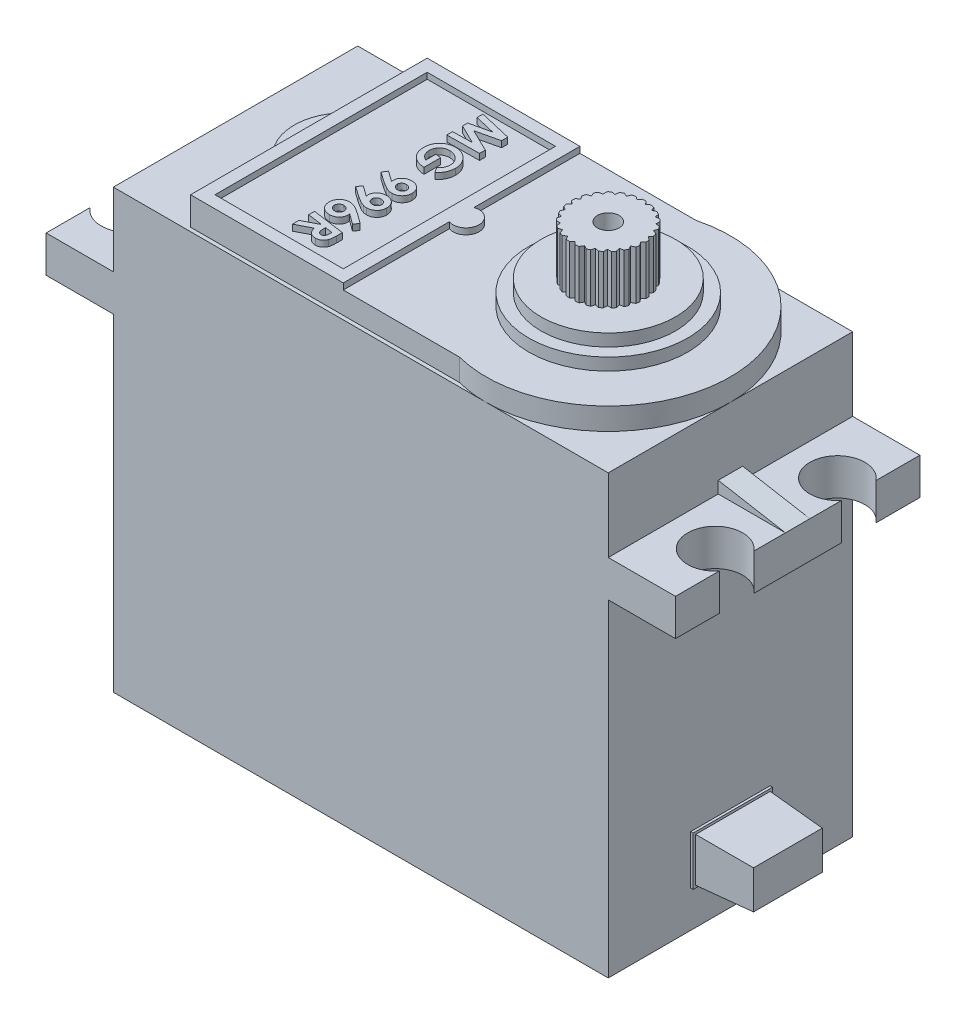
from build123d import *

# Parameters (mm, degrees)
ESQUISSE2_W             = 40.5
ESQUISSE2_H             = 20
BOSS_EXTRU_1_DEPTH      = 36.8
CHANFREIN1_SIZE         = 1
ESQUISSE3_W             = 6.5
ESQUISSE3_H             = 4
BOSS_EXTRU_2_DEPTH      = 0.2
ESQUISSE4_W             = 6.1
ESQUISSE4_H             = 3.6
BOSS_EXTRU_3_DEPTH      = 4.5
BOSS_EXTRU_3_TAPER      = 3
ESQUISSE5_W             = 5.5
ESQUISSE5_H             = 20
BOSS_EXTRU_4_DEPTH      = 3
BOSS_EXTRU_5_DEPTH      = 1.8
ESQUISSE8_W             = 12.5
ESQUISSE8_H             = 19.364916732
ESQUISSE8_W_2           = 10.5
ESQUISSE8_H_2           = 17.364916732
BOSS_EXTRU_6_DEPTH      = 0.5
NERVURE1_REACH          = 63.195
ESQUISSE6_WALL_W        = 129.97512572
ESQUISSE6_WALL_H        = 2
ESQUISSE9_R             = 2.25
ENL_V_MAT_EXTRU_1_DEPTH = 3
ESQUISSE10_R            = 1.069362743
BOSS_EXTRU_7_DEPTH      = 0.5
ESQUISSE11_R            = 6.5
BOSS_EXTRU_8_DEPTH      = 1
ESQUISSE12_R            = 5.5
BOSS_EXTRU_9_DEPTH      = 1
ESQUISSE13_R            = 3
BOSS_EXTRU_10_DEPTH     = 4
ENL_V_START             = -4
ENL_V_MAT_EXTRU_2_DEPTH = 4
TROU_TARAUD_2_561_D     = 1.778
TROU_TARAUD_2_561_DEPTH = 6.64
TROU_TARAUD_2_561_TIP   = 0.53416509
ENL_V_MAT_EXTRU_3_DEPTH = 0.5


with BuildPart() as part:
    # Esquisse2 → Boss.-Extru.1 (new body)
    with BuildSketch(Plane(origin=(0, 0, 0), x_dir=(1, 0, 0), z_dir=(0, 1, 0))):
        with Locations((20.25, 10)):
            Rectangle(ESQUISSE2_W, ESQUISSE2_H)
    extrude(amount=BOSS_EXTRU_1_DEPTH)

    # Chanfrein1
    chanfrein1_edges = [part.edges().sort_by_distance(p)[0] for p in [
        (20.25, 0, -20),
        (40.5, 0, -10),
        (20.25, 0, 0),
        (0, 0, -10),
    ]]
    chamfer(chanfrein1_edges, length=CHANFREIN1_SIZE)

    # Esquisse3 → Boss.-Extru.2 (add)
    with BuildSketch(Plane(origin=(40.5, 0, 0), x_dir=(0, 0, -1), z_dir=(1, 0, 0))):
        with Locations((10, 6)):
            Rectangle(ESQUISSE3_W, ESQUISSE3_H)
    extrude(amount=BOSS_EXTRU_2_DEPTH)

    # Esquisse4 → Boss.-Extru.3 (add)
    with BuildSketch(Plane(origin=(40.7, 0, 0), x_dir=(0, 0, -1), z_dir=(1, 0, 0))):
        with Locations((10, 6)):
            Rectangle(ESQUISSE4_W, ESQUISSE4_H)
    extrude(amount=BOSS_EXTRU_3_DEPTH, taper=BOSS_EXTRU_3_TAPER)

    # Esquisse5 → Boss.-Extru.4 (add)
    with BuildSketch(Plane(origin=(0, 30.8, 0), x_dir=(1, 0, 0), z_dir=(0, 1, 0))):
        with Locations((43.25, 10)):
            Rectangle(ESQUISSE5_W, ESQUISSE5_H)
        with Locations((-2.75, 10)):
            Rectangle(ESQUISSE5_W, ESQUISSE5_H)
    extrude(amount=-BOSS_EXTRU_4_DEPTH)

    # Esquisse7 → Boss.-Extru.5 (add)
    with BuildSketch(Plane(origin=(0, 36.8, 0), x_dir=(1, 0, 0), z_dir=(0, 1, 0))):
        with BuildLine():
            Line((28, 19.682458366), (6, 19.682458366))
            Line((6, 19.682458366), (6, 12.939387691))
            ThreePointArc((6, 12.939387691), (4.8, 10), (6, 7.060612309))
            Line((6, 7.060612309), (6, 0.317541634))
            Line((6, 0.317541634), (28, 0.317541634))
            ThreePointArc((28, 0.317541634), (40.5, 10), (28, 19.682458366))
        make_face()
    extrude(amount=BOSS_EXTRU_5_DEPTH)

    # Esquisse8 → Boss.-Extru.6 (add)
    with BuildSketch(Plane(origin=(0, 38.6, 0), x_dir=(1, 0, 0), z_dir=(0, 1, 0))):
        with Locations((12.25, 10)):
            Rectangle(ESQUISSE8_W, ESQUISSE8_H)
        with Locations((12.25, 10)):
            Rectangle(ESQUISSE8_W_2, ESQUISSE8_H_2, mode=Mode.SUBTRACT)
    extrude(amount=BOSS_EXTRU_6_DEPTH)

    # Esquisse6 wall → Nervure1 (add, up to next)
    with BuildSketch(Plane(origin=(43.25, 31.28654897, -10), x_dir=(-0.98470656344, 0.17422107771, 0), z_dir=(0.17422107771, 0.98470656344, 0)), mode=Mode.PRIVATE) as nervure1_sk1:
        Rectangle(ESQUISSE6_WALL_W, ESQUISSE6_WALL_H)
    nervure1_tool1 = extrude(nervure1_sk1.sketch, amount=-NERVURE1_REACH, mode=Mode.PRIVATE) - part.part
    nervure1 = nervure1_tool1.solids().sort_by_distance((43.25, 31.28654897, -10))[0]
    add(nervure1)

    # Symétrie1: Nervure1 across plane
    add(nervure1.mirror(Plane.ZY.offset(-20.25)))

    # Esquisse9 → Enlèv. mat.-Extru.1 (cut)
    with BuildSketch(Plane(origin=(0, 30.8, 0), x_dir=(1, 0, 0), z_dir=(0, 1, 0))):
        with Locations((-3.75, 15)):
            Circle(ESQUISSE9_R)
        with Locations((-3.75, 5)):
            Circle(ESQUISSE9_R)
        with Locations((44.25, 15)):
            Circle(ESQUISSE9_R)
        with Locations((44.25, 5)):
            Circle(ESQUISSE9_R)
    extrude(amount=-ENL_V_MAT_EXTRU_1_DEPTH, mode=Mode.SUBTRACT)

    # Esquisse10 → Boss.-Extru.7 (add)
    # profile 1 of 7: a face of its own
    with BuildSketch(Plane(origin=(0, 38.6, 0), x_dir=(1, 0, 0), z_dir=(0, 1, 0))):
        with Locations((18.863979038, 10)):
            Circle(ESQUISSE10_R)
    # profile 2 of 7: a face of its own
    with BuildSketch(Plane(origin=(0, 38.6, 0), x_dir=(1, 0, 0), z_dir=(0, 1, 0))):
        Polygon((14.895833333, 17.378864517), (14.895833333, 16.873760517), (13.052442241, 16.444978632), (14.895833333, 15.539713542), (14.895833333, 15.071180556), (12.25, 15.037259615), (12.25, 15.512152778), (13.832623865, 15.546073718), (12.25, 16.323075254), (12.25, 16.737016727), (13.912126068, 17.123397436), (12.25, 17.514018263), (12.25, 18.000571748), align=None)
    # profile 3 of 7: a face of its own
    with BuildSketch(Plane(origin=(0, 38.6, 0), x_dir=(1, 0, 0), z_dir=(0, 1, 0))):
        with BuildLine():
            Line((14.413519965, 11.893212473), (14.14957265, 12.314574152))
            add(Edge.make_bspline(
                [(14.14957265, 12.314574152), (14.182226607, 12.344452028), (14.244607538, 12.401529634), (14.325928731, 12.491063998), (14.391922335, 12.578848082), (14.441898984, 12.667154377), (14.478787705, 12.757700404), (14.503895804, 12.852666333), (14.519754731, 12.95306459), (14.521705169, 13.021906131), (14.522702991, 13.057124733)],
                knots=[0, 0, 0, 0, 1.232885797, 2.355260147, 3.365556625, 4.287066597, 5.174814994, 6.082477048, 7.019015608, 8, 8, 8, 8], degree=3))
            add(Edge.make_bspline(
                [(14.522702991, 13.057124733), (14.521686925, 13.095364384), (14.519689994, 13.170518887), (14.500873636, 13.280150935), (14.471871138, 13.384693694), (14.430547824, 13.483730957), (14.37602753, 13.576738756), (14.310603553, 13.664500855), (14.233259477, 13.746911503), (14.174343486, 13.795530523), (14.144272503, 13.820345887)],
                knots=[0, 0, 0, 0, 1.037071857, 2.038214738, 3.009729149, 3.976855325, 4.941565424, 5.928389831, 6.942640983, 8, 8, 8, 8], degree=3))
            add(Edge.make_bspline(
                [(14.144272503, 13.820345887), (14.119098074, 13.838925772), (14.069293607, 13.875683755), (13.990748516, 13.923561019), (13.909783045, 13.96314346), (13.827256952, 13.9966325), (13.742303924, 14.021687181), (13.655425835, 14.040764914), (13.566285141, 14.051240002), (13.506159608, 14.052778618), (13.475923978, 14.05355235)],
                knots=[0, 0, 0, 0, 1.040839251, 2.059170575, 3.055630366, 4.037062373, 5.019110465, 5.999220985, 6.993858158, 8, 8, 8, 8], degree=3))
            add(Edge.make_bspline(
                [(13.475923978, 14.05355235), (13.446389285, 14.052838649), (13.388165025, 14.051431667), (13.302693434, 14.040347229), (13.221068283, 14.020814449), (13.142669436, 13.995202178), (13.068207437, 13.960903979), (12.997347209, 13.919389191), (12.930280706, 13.870317718), (12.86756691, 13.81430086), (12.810308914, 13.753008656), (12.76012294, 13.687570953), (12.717880889, 13.618626076), (12.683290563, 13.546146381), (12.656064777, 13.470176978), (12.637183746, 13.390531597), (12.625034783, 13.307666938), (12.623771226, 13.251153353), (12.623130342, 13.222489316)],
                knots=[0, 0, 0, 0, 1.066897471, 2.103265977, 3.106535126, 4.095591644, 5.078159493, 6.062322472, 7.058152725, 8.075375883, 9.096057735, 10.084186963, 11.049730852, 12.011871914, 12.980953841, 13.959387168, 14.96498868, 16, 16, 16, 16], degree=3))
            add(Edge.make_bspline(
                [(12.623130342, 13.222489316), (12.62352997, 13.200919765), (12.624321167, 13.158215716), (12.630867198, 13.094984655), (12.641499585, 13.033188568), (12.656192684, 12.972909638), (12.675512208, 12.914154242), (12.698930203, 12.856798498), (12.726293103, 12.80068424), (12.758406832, 12.746436633), (12.794238655, 12.693968773), (12.834685352, 12.644022395), (12.879496236, 12.596709454), (12.928435307, 12.551650676), (12.98124162, 12.508551759), (13.039018432, 12.46894969), (13.100490782, 12.431075996), (13.143816269, 12.408311625), (13.165865385, 12.396726429)],
                knots=[0, 0, 0, 0, 0.990751711, 1.961520103, 2.916931976, 3.869720035, 4.809138875, 5.755683625, 6.713987145, 7.674487982, 8.649319602, 9.630449541, 10.623757948, 11.640402946, 12.684918653, 13.752145235, 14.856026455, 16, 16, 16, 16], degree=3))
            Line((13.165865385, 12.396726429), (13.165865385, 13.232029581))
            Line((13.165865385, 13.232029581), (13.606837607, 13.171607906))
            Line((13.606837607, 13.171607906), (13.606837607, 11.814770299))
            add(Edge.make_bspline(
                [(13.606837607, 11.814770299), (13.553576953, 11.818164211), (13.449423544, 11.824801144), (13.297763777, 11.848819667), (13.154737828, 11.884392058), (13.019794624, 11.930502134), (12.893185857, 11.987615425), (12.775254695, 12.056619555), (12.665557739, 12.136162474), (12.565533037, 12.226966773), (12.475782242, 12.326397844), (12.396489875, 12.432596793), (12.330718138, 12.54636996), (12.276386727, 12.666200695), (12.233654404, 12.792560622), (12.203696237, 12.925771009), (12.185230178, 13.065613979), (12.183194733, 13.161126321), (12.18215812, 13.209768964)],
                knots=[0, 0, 0, 0, 1.148955532, 2.246830018, 3.301660101, 4.319666133, 5.314146826, 6.287838685, 7.257462643, 8.227280698, 9.191724348, 10.138440807, 11.076252923, 12.016254752, 12.968042649, 13.943717582, 14.952773983, 16, 16, 16, 16], degree=3))
            add(Edge.make_bspline(
                [(12.18215812, 13.209768964), (12.182422747, 13.236454621), (12.182945535, 13.289173934), (12.188315617, 13.367019666), (12.197484811, 13.442677664), (12.209525355, 13.516102052), (12.224926848, 13.587610509), (12.243849953, 13.656857329), (12.266805344, 13.724078008), (12.293385572, 13.788833866), (12.322306691, 13.852052819), (12.356049468, 13.912245692), (12.392500992, 13.970865644), (12.432978605, 14.026931448), (12.476454014, 14.081266613), (12.523609892, 14.133053839), (12.574262899, 14.1827447), (12.610237054, 14.213807595), (12.628430489, 14.229517228)],
                knots=[0, 0, 0, 0, 1.111489437, 2.195822267, 3.24832009, 4.285186852, 5.294177098, 6.294000398, 7.273796753, 8.250936178, 9.209044775, 10.167605497, 11.123223585, 12.083111191, 13.046265838, 14.020518746, 14.998904505, 16, 16, 16, 16], degree=3))
            add(Edge.make_bspline(
                [(12.628430489, 14.229517228), (12.658588763, 14.253396792), (12.718466815, 14.300808715), (12.814947345, 14.361673055), (12.915566575, 14.413613317), (13.020838592, 14.455207788), (13.12995092, 14.488460722), (13.243503183, 14.511673433), (13.361266447, 14.525638713), (13.441258231, 14.527502148), (13.48175414, 14.528445513)],
                knots=[0, 0, 0, 0, 0.999328569, 1.984127054, 2.959716786, 3.938705326, 4.922250225, 5.921072174, 6.947541011, 8, 8, 8, 8], degree=3))
            add(Edge.make_bspline(
                [(13.48175414, 14.528445513), (13.53129847, 14.527173323), (13.629061566, 14.52466298), (13.77282981, 14.503175961), (13.911565339, 14.469386095), (14.045327899, 14.42159429), (14.173480699, 14.359024131), (14.296477058, 14.283156585), (14.414850664, 14.194334344), (14.525642072, 14.092177215), (14.628023605, 13.981364426), (14.717958358, 13.863705939), (14.793658228, 13.740327698), (14.856346862, 13.612238591), (14.904011351, 13.478215362), (14.938507887, 13.339436142), (14.959884545, 13.195238002), (14.962398803, 13.097302998), (14.963675214, 13.047584468)],
                knots=[0, 0, 0, 0, 1.022497491, 2.017637963, 2.994389496, 3.967079589, 4.944335062, 5.93346684, 6.946839843, 7.995112064, 9.040696054, 10.058471571, 11.04760335, 12.024858823, 12.997548916, 13.978718102, 14.973858573, 16, 16, 16, 16], degree=3))
            add(Edge.make_bspline(
                [(14.963675214, 13.047584468), (14.963073734, 13.010268263), (14.96187604, 12.935962555), (14.948764051, 12.825348338), (14.929734364, 12.715895027), (14.901241146, 12.608753554), (14.866779416, 12.50483789), (14.825069394, 12.405472052), (14.77709042, 12.311265198), (14.721760549, 12.221593179), (14.658650029, 12.135656527), (14.58655147, 12.051845362), (14.504433106, 11.970418038), (14.444260862, 11.919318362), (14.413519965, 11.893212473)],
                knots=[0, 0, 0, 0, 1.013985835, 2.019094276, 3.024340414, 4.032027573, 5.029903266, 5.998629461, 6.958804651, 7.901192451, 8.859925033, 9.854431412, 10.903868303, 12, 12, 12, 12], degree=3))
        make_face()
    # profile 4 of 7: a face of its own
    with BuildSketch(Plane(origin=(0, 38.6, 0), x_dir=(1, 0, 0), z_dir=(0, 1, 0))):
        with BuildLine():
            Line((12.18215812, 9.722272302), (12.428084936, 10.089572483))
            Line((12.428084936, 10.089572483), (13.292008881, 9.478465545))
            add(Edge.make_bspline(
                [(13.292008881, 9.478465545), (13.285044745, 9.507656953), (13.271936971, 9.562600513), (13.269003247, 9.618990213), (13.267628205, 9.645420172)],
                knots=[0, 0, 0, 0, 1.062596194, 2, 2, 2, 2], degree=3))
            add(Edge.make_bspline(
                [(13.267628205, 9.645420172), (13.268370326, 9.669484416), (13.269834611, 9.716965777), (13.280592147, 9.786868361), (13.298781282, 9.853969752), (13.323754696, 9.91858972), (13.356185706, 9.980380058), (13.396602665, 10.038934361), (13.443356714, 10.095229716), (13.496534781, 10.148553985), (13.555489352, 10.196736567), (13.618316863, 10.239579909), (13.684811225, 10.275591006), (13.754446078, 10.305488754), (13.827595228, 10.328505371), (13.904383904, 10.343920384), (13.984439422, 10.354607871), (14.039116571, 10.355643708), (14.066890358, 10.356169872)],
                knots=[0, 0, 0, 0, 0.970086177, 1.914085144, 2.843757081, 3.768448548, 4.702069427, 5.650466095, 6.631863717, 7.649361026, 8.681859104, 9.697409525, 10.711084413, 11.725960042, 12.748829391, 13.796646255, 14.880785151, 16, 16, 16, 16], degree=3))
            add(Edge.make_bspline(
                [(14.066890358, 10.356169872), (14.098197844, 10.355518936), (14.159801729, 10.354238085), (14.250317834, 10.342276224), (14.336868289, 10.322673607), (14.419579012, 10.2957472), (14.497774244, 10.260469755), (14.572078653, 10.217814045), (14.642299223, 10.16708307), (14.708049837, 10.109288105), (14.76770795, 10.045249169), (14.820616324, 9.976906928), (14.864955402, 9.903596822), (14.900928581, 9.826020649), (14.929315065, 9.744194602), (14.949369106, 9.658239669), (14.961103379, 9.567831814), (14.962805317, 9.506237563), (14.963675214, 9.474755442)],
                knots=[0, 0, 0, 0, 1.067153374, 2.099842657, 3.106801845, 4.089832761, 5.060584944, 6.026765153, 7.006523203, 8.009636506, 9.007035051, 9.986663441, 10.951659663, 11.921944397, 12.897414564, 13.899858298, 14.926573288, 16, 16, 16, 16], degree=3))
            add(Edge.make_bspline(
                [(14.963675214, 9.474755442), (14.963051152, 9.446088804), (14.961824572, 9.389745137), (14.949549956, 9.307470148), (14.931272291, 9.228678737), (14.904666719, 9.153625098), (14.86994262, 9.082315393), (14.827840697, 9.014643187), (14.778218026, 8.950774394), (14.721695011, 8.891211855), (14.659741804, 8.837106924), (14.593764232, 8.789645513), (14.524432178, 8.749486789), (14.451309401, 8.717100659), (14.374775546, 8.691728494), (14.295030193, 8.672898961), (14.211692758, 8.66233727), (14.155078169, 8.660869964), (14.126252003, 8.660122863)],
                knots=[0, 0, 0, 0, 1.054249505, 2.072105013, 3.054563783, 4.027228313, 4.995537151, 5.967962625, 6.955035867, 7.966830736, 8.985184481, 9.977553814, 10.953342403, 11.928372592, 12.915253103, 13.916696589, 14.939254872, 16, 16, 16, 16], degree=3))
            add(Edge.make_bspline(
                [(14.126252003, 8.660122863), (14.102914166, 8.660489033), (14.056488057, 8.661217456), (13.987588394, 8.668329291), (13.919779494, 8.679961529), (13.875492157, 8.691107359), (13.853294438, 8.696693877)],
                knots=[0, 0, 0, 0, 1.013662365, 2.016484985, 3.005821674, 4, 4, 4, 4], degree=3))
            add(Edge.make_bspline(
                [(13.853294438, 8.696693877), (13.821887718, 8.706370116), (13.759147027, 8.725700181), (13.667547042, 8.761743499), (13.577671496, 8.801709608), (13.519749284, 8.832393511), (13.49076439, 8.847748064)],
                knots=[0, 0, 0, 0, 1.00191864, 2.001516544, 2.999937518, 4, 4, 4, 4], degree=3))
            add(Edge.make_bspline(
                [(13.49076439, 8.847748064), (13.441653178, 8.874830127), (13.345151324, 8.928045457), (13.205430961, 9.011901855), (13.071945365, 9.095963773), (12.986700987, 9.154861062), (12.944849259, 9.183777377)],
                knots=[0, 0, 0, 0, 1.049210121, 2.061662041, 3.048350216, 4, 4, 4, 4], degree=3))
            Line((12.944849259, 9.183777377), (12.18215812, 9.722272302))
        make_face()
        with BuildLine():
            add(Edge.make_bspline(
                [(13.708600427, 9.524576823), (13.709035217, 9.511479633), (13.709897329, 9.485510159), (13.715941075, 9.447349734), (13.725212391, 9.410397192), (13.739586639, 9.375402111), (13.75610301, 9.340901898), (13.778364906, 9.308978323), (13.803206007, 9.277666857), (13.832488349, 9.249102596), (13.863528526, 9.222008653), (13.897627985, 9.199422824), (13.932225857, 9.178769487), (13.969324504, 9.163200063), (14.007258901, 9.150034634), (14.047232721, 9.14207625), (14.088234294, 9.135580956), (14.116330443, 9.135205348), (14.130492121, 9.135016026)],
                knots=[0, 0, 0, 0, 0.985210318, 1.953502403, 2.901504212, 3.844552657, 4.795811415, 5.772915833, 6.765364857, 7.799414466, 8.846288802, 9.8603182, 10.872777757, 11.873031683, 12.88199396, 13.888500911, 14.935712839, 16, 16, 16, 16], degree=3))
            add(Edge.make_bspline(
                [(14.130492121, 9.135016026), (14.157143961, 9.13604922), (14.209147112, 9.138065192), (14.283241468, 9.159330417), (14.351318483, 9.191840168), (14.400879842, 9.230569974), (14.435944253, 9.266404387), (14.459417419, 9.294714951), (14.478648472, 9.325214323), (14.495268824, 9.356524442), (14.507446426, 9.390138865), (14.51644421, 9.424897614), (14.521948085, 9.461330131), (14.522448573, 9.486043361), (14.522702991, 9.498606103)],
                knots=[0, 0, 0, 0, 1.605710682, 3.133067493, 4.617246605, 6.139001981, 6.901113253, 7.644390981, 8.354770773, 9.075414747, 9.781050313, 10.508300066, 11.241708108, 12, 12, 12, 12], degree=3))
            add(Edge.make_bspline(
                [(14.522702991, 9.498606103), (14.522269913, 9.511877837), (14.521416852, 9.53801998), (14.515432771, 9.576394246), (14.505848066, 9.613140623), (14.492811368, 9.648395673), (14.474739767, 9.681484135), (14.453796485, 9.713340538), (14.428323669, 9.74334752), (14.399563232, 9.771525131), (14.368061273, 9.797369413), (14.334280593, 9.819814185), (14.298862501, 9.838986534), (14.261454941, 9.854239777), (14.222551458, 9.86677054), (14.181632759, 9.874880111), (14.138956083, 9.880581667), (14.109841649, 9.881041833), (14.094981136, 9.881276709)],
                knots=[0, 0, 0, 0, 0.99542305, 1.960745347, 2.905839599, 3.841219243, 4.772081027, 5.727802437, 6.696757192, 7.718306701, 8.745001724, 9.748509204, 10.756557466, 11.760764865, 12.775153388, 13.817469606, 14.885998626, 16, 16, 16, 16], degree=3))
            add(Edge.make_bspline(
                [(14.094981136, 9.881276709), (14.068706262, 9.880141045), (14.017537033, 9.877929387), (13.944133473, 9.858128398), (13.877187411, 9.826087871), (13.828333169, 9.788589095), (13.793554419, 9.754137239), (13.770977448, 9.726130977), (13.751346378, 9.69670676), (13.736291493, 9.665301665), (13.723777186, 9.632565508), (13.714818203, 9.598112565), (13.709359371, 9.561853625), (13.708856206, 9.537139845), (13.708600427, 9.524576823)],
                knots=[0, 0, 0, 0, 1.609136234, 3.133726194, 4.626556867, 6.135078296, 6.886042596, 7.625661421, 8.33802277, 9.050466543, 9.75695111, 10.485047691, 11.229887978, 12, 12, 12, 12], degree=3))
        make_face(mode=Mode.SUBTRACT)
    # profile 5 of 7: a face of its own
    with BuildSketch(Plane(origin=(0, 38.6, 0), x_dir=(1, 0, 0), z_dir=(0, 1, 0))):
        with BuildLine():
            Line((12.18215812, 7.653094952), (12.428084936, 8.020395132))
            Line((12.428084936, 8.020395132), (13.292008881, 7.409288194))
            add(Edge.make_bspline(
                [(13.292008881, 7.409288194), (13.285044745, 7.438479603), (13.271936971, 7.493423162), (13.269003247, 7.549812862), (13.267628205, 7.576242822)],
                knots=[0, 0, 0, 0, 1.062596194, 2, 2, 2, 2], degree=3))
            add(Edge.make_bspline(
                [(13.267628205, 7.576242822), (13.268370326, 7.600307066), (13.269834611, 7.647788427), (13.280592147, 7.717691011), (13.298781282, 7.784792402), (13.323754696, 7.84941237), (13.356185706, 7.911202708), (13.396602665, 7.96975701), (13.443356714, 8.026052366), (13.496534781, 8.079376634), (13.555489352, 8.127559217), (13.618316863, 8.170402559), (13.684811225, 8.206413656), (13.754446078, 8.236311403), (13.827595228, 8.259328021), (13.904383904, 8.274743034), (13.984439422, 8.285430521), (14.039116571, 8.286466358), (14.066890358, 8.286992521)],
                knots=[0, 0, 0, 0, 0.970086177, 1.914085144, 2.843757081, 3.768448548, 4.702069427, 5.650466095, 6.631863717, 7.649361026, 8.681859104, 9.697409525, 10.711084413, 11.725960042, 12.748829391, 13.796646255, 14.880785151, 16, 16, 16, 16], degree=3))
            add(Edge.make_bspline(
                [(14.066890358, 8.286992521), (14.098197844, 8.286341585), (14.159801729, 8.285060735), (14.250317834, 8.273098874), (14.336868289, 8.253496257), (14.419579012, 8.22656985), (14.497774244, 8.191292404), (14.572078653, 8.148636695), (14.642299223, 8.09790572), (14.708049837, 8.040110754), (14.76770795, 7.976071819), (14.820616324, 7.907729577), (14.864955402, 7.834419472), (14.900928581, 7.756843298), (14.929315065, 7.675017251), (14.949369106, 7.589062318), (14.961103379, 7.498654464), (14.962805317, 7.437060212), (14.963675214, 7.405578092)],
                knots=[0, 0, 0, 0, 1.067153374, 2.099842657, 3.106801845, 4.089832761, 5.060584944, 6.026765153, 7.006523203, 8.009636506, 9.007035051, 9.986663441, 10.951659663, 11.921944397, 12.897414564, 13.899858298, 14.926573288, 16, 16, 16, 16], degree=3))
            add(Edge.make_bspline(
                [(14.963675214, 7.405578092), (14.963051152, 7.376911454), (14.961824572, 7.320567786), (14.949549956, 7.238292797), (14.931272291, 7.159501386), (14.904666719, 7.084447748), (14.86994262, 7.013138043), (14.827840697, 6.945465836), (14.778218026, 6.881597044), (14.721695011, 6.822034504), (14.659741804, 6.767929574), (14.593764232, 6.720468163), (14.524432178, 6.680309439), (14.451309401, 6.647923309), (14.374775546, 6.622551144), (14.295030193, 6.60372161), (14.211692758, 6.593159919), (14.155078169, 6.591692613), (14.126252003, 6.590945513)],
                knots=[0, 0, 0, 0, 1.054249505, 2.072105013, 3.054563783, 4.027228313, 4.995537151, 5.967962625, 6.955035867, 7.966830736, 8.985184481, 9.977553814, 10.953342403, 11.928372592, 12.915253103, 13.916696589, 14.939254872, 16, 16, 16, 16], degree=3))
            add(Edge.make_bspline(
                [(14.126252003, 6.590945513), (14.102914166, 6.591311682), (14.056488057, 6.592040106), (13.987588394, 6.59915194), (13.919779494, 6.610784179), (13.875492157, 6.621930009), (13.853294438, 6.627516526)],
                knots=[0, 0, 0, 0, 1.013662365, 2.016484985, 3.005821674, 4, 4, 4, 4], degree=3))
            add(Edge.make_bspline(
                [(13.853294438, 6.627516526), (13.821887718, 6.637192765), (13.759147027, 6.65652283), (13.667547042, 6.692566149), (13.577671496, 6.732532258), (13.519749284, 6.76321616), (13.49076439, 6.778570713)],
                knots=[0, 0, 0, 0, 1.00191864, 2.001516544, 2.999937518, 4, 4, 4, 4], degree=3))
            add(Edge.make_bspline(
                [(13.49076439, 6.778570713), (13.441653178, 6.805652777), (13.345151324, 6.858868107), (13.205430961, 6.942724505), (13.071945365, 7.026786422), (12.986700987, 7.085683711), (12.944849259, 7.114600027)],
                knots=[0, 0, 0, 0, 1.049210121, 2.061662041, 3.048350216, 4, 4, 4, 4], degree=3))
            Line((12.944849259, 7.114600027), (12.18215812, 7.653094952))
        make_face()
        with BuildLine():
            add(Edge.make_bspline(
                [(13.708600427, 7.455399472), (13.709035217, 7.442302282), (13.709897329, 7.416332809), (13.715941075, 7.378172383), (13.725212391, 7.341219842), (13.739586639, 7.30622476), (13.75610301, 7.271724548), (13.778364906, 7.239800973), (13.803206007, 7.208489506), (13.832488349, 7.179925245), (13.863528526, 7.152831302), (13.897627985, 7.130245474), (13.932225857, 7.109592136), (13.969324504, 7.094022712), (14.007258901, 7.080857283), (14.047232721, 7.0728989), (14.088234294, 7.066403606), (14.116330443, 7.066027998), (14.130492121, 7.065838675)],
                knots=[0, 0, 0, 0, 0.985210318, 1.953502403, 2.901504212, 3.844552657, 4.795811415, 5.772915833, 6.765364857, 7.799414466, 8.846288802, 9.8603182, 10.872777757, 11.873031683, 12.88199396, 13.888500911, 14.935712839, 16, 16, 16, 16], degree=3))
            add(Edge.make_bspline(
                [(14.130492121, 7.065838675), (14.157143961, 7.06687187), (14.209147112, 7.068887842), (14.283241468, 7.090153067), (14.351318483, 7.122662817), (14.400879842, 7.161392623), (14.435944253, 7.197227037), (14.459417419, 7.225537601), (14.478648472, 7.256036972), (14.495268824, 7.287347092), (14.507446426, 7.320961514), (14.51644421, 7.355720264), (14.521948085, 7.392152781), (14.522448573, 7.416866011), (14.522702991, 7.429428753)],
                knots=[0, 0, 0, 0, 1.605710682, 3.133067493, 4.617246605, 6.139001981, 6.901113253, 7.644390981, 8.354770773, 9.075414747, 9.781050313, 10.508300066, 11.241708108, 12, 12, 12, 12], degree=3))
            add(Edge.make_bspline(
                [(14.522702991, 7.429428753), (14.522269913, 7.442700487), (14.521416852, 7.468842629), (14.515432771, 7.507216895), (14.505848066, 7.543963272), (14.492811368, 7.579218323), (14.474739767, 7.612306785), (14.453796485, 7.644163187), (14.428323669, 7.67417017), (14.399563232, 7.702347781), (14.368061273, 7.728192063), (14.334280593, 7.750636835), (14.298862501, 7.769809184), (14.261454941, 7.785062426), (14.222551458, 7.79759319), (14.181632759, 7.80570276), (14.138956083, 7.811404317), (14.109841649, 7.811864483), (14.094981136, 7.812099359)],
                knots=[0, 0, 0, 0, 0.99542305, 1.960745347, 2.905839599, 3.841219243, 4.772081027, 5.727802437, 6.696757192, 7.718306701, 8.745001724, 9.748509204, 10.756557466, 11.760764865, 12.775153388, 13.817469606, 14.885998626, 16, 16, 16, 16], degree=3))
            add(Edge.make_bspline(
                [(14.094981136, 7.812099359), (14.068706262, 7.810963695), (14.017537033, 7.808752037), (13.944133473, 7.788951048), (13.877187411, 7.756910521), (13.828333169, 7.719411745), (13.793554419, 7.684959889), (13.770977448, 7.656953627), (13.751346378, 7.62752941), (13.736291493, 7.596124314), (13.723777186, 7.563388158), (13.714818203, 7.528935214), (13.709359371, 7.492676275), (13.708856206, 7.467962495), (13.708600427, 7.455399472)],
                knots=[0, 0, 0, 0, 1.609136234, 3.133726194, 4.626556867, 6.135078296, 6.886042596, 7.625661421, 8.33802277, 9.050466543, 9.75695111, 10.485047691, 11.229887978, 12, 12, 12, 12], degree=3))
        make_face(mode=Mode.SUBTRACT)
    # profile 6 of 7: a face of its own
    with BuildSketch(Plane(origin=(0, 38.6, 0), x_dir=(1, 0, 0), z_dir=(0, 1, 0))):
        with BuildLine():
            Line((14.963675214, 5.230397803), (14.715628339, 4.856207432))
            Line((14.715628339, 4.856207432), (13.851704394, 5.485864884))
            add(Edge.make_bspline(
                [(13.851704394, 5.485864884), (13.855777165, 5.470715729), (13.863728117, 5.441141223), (13.872191365, 5.397426144), (13.877192941, 5.355775866), (13.877874367, 5.328816242), (13.878205128, 5.315730168)],
                knots=[0, 0, 0, 0, 1.089609887, 2.127159907, 3.090932268, 4, 4, 4, 4], degree=3))
            add(Edge.make_bspline(
                [(13.878205128, 5.315730168), (13.877455949, 5.291139017), (13.875977463, 5.242609027), (13.865343356, 5.171263743), (13.846877066, 5.102859399), (13.822428086, 5.036669894), (13.788610828, 4.97408479), (13.749721534, 4.913170376), (13.702436464, 4.855723128), (13.648843314, 4.801832949), (13.590345582, 4.752077921), (13.527647789, 4.708348257), (13.461160341, 4.671691674), (13.391289018, 4.641967567), (13.318202403, 4.618497671), (13.241588402, 4.601540225), (13.161376791, 4.591258551), (13.106710995, 4.590165347), (13.078942975, 4.589610043)],
                knots=[0, 0, 0, 0, 0.981715411, 1.937389526, 2.871580341, 3.806968751, 4.747211669, 5.7059007, 6.688578603, 7.711082162, 8.737083298, 9.750667409, 10.757800367, 11.76273248, 12.777714656, 13.818234204, 14.891750959, 16, 16, 16, 16], degree=3))
            add(Edge.make_bspline(
                [(13.078942975, 4.589610043), (13.047626205, 4.590195647), (12.985980854, 4.591348377), (12.89557458, 4.604250308), (12.808859798, 4.623457814), (12.726242983, 4.65115616), (12.64780308, 4.686971739), (12.573278252, 4.730507867), (12.503005379, 4.782469313), (12.437061226, 4.841306691), (12.37770705, 4.906732716), (12.325075182, 4.976555907), (12.280857948, 5.05122745), (12.244894792, 5.130388417), (12.216523098, 5.213799613), (12.19640816, 5.301504048), (12.18476632, 5.393682475), (12.183038507, 5.456504628), (12.18215812, 5.488514957)],
                knots=[0, 0, 0, 0, 1.056630681, 2.079919763, 3.076949805, 4.052168332, 5.015806961, 5.983608992, 6.960722918, 7.961866351, 8.962583205, 9.938458249, 10.909288654, 11.886256911, 12.869035103, 13.879024606, 14.919280581, 16, 16, 16, 16], degree=3))
            add(Edge.make_bspline(
                [(12.18215812, 5.488514957), (12.182771049, 5.517714457), (12.183976035, 5.575119069), (12.196441717, 5.659095322), (12.214148245, 5.739717696), (12.242126788, 5.815827984), (12.275525659, 5.888955989), (12.318217242, 5.957628308), (12.367378299, 6.023050074), (12.424135297, 6.083684711), (12.486083392, 6.13881837), (12.551885588, 6.187452832), (12.621634459, 6.228108402), (12.694643851, 6.261373485), (12.771104938, 6.287696008), (12.850864632, 6.306044721), (12.934089361, 6.317560317), (12.990745655, 6.318897448), (13.01958133, 6.319577991)],
                knots=[0, 0, 0, 0, 1.063306671, 2.090402461, 3.088389398, 4.065895744, 5.03947144, 6.013408992, 7.006231883, 8.017587523, 9.034563496, 10.024857058, 10.99440066, 11.971122141, 12.944378439, 13.936094236, 14.949558597, 16, 16, 16, 16], degree=3))
            add(Edge.make_bspline(
                [(13.01958133, 6.319577991), (13.042921851, 6.31922767), (13.089353298, 6.318530775), (13.158184079, 6.311188599), (13.226112298, 6.300438346), (13.270351147, 6.289182366), (13.292538896, 6.283536993)],
                knots=[0, 0, 0, 0, 1.013987145, 2.017131071, 3.005503137, 4, 4, 4, 4], degree=3))
            add(Edge.make_bspline(
                [(13.292538896, 6.283536993), (13.323741277, 6.27396831), (13.386165242, 6.254825055), (13.477876365, 6.220248987), (13.56771698, 6.180480445), (13.625891585, 6.150279902), (13.655068944, 6.135132879)],
                knots=[0, 0, 0, 0, 0.997754642, 1.996123332, 2.994959615, 4, 4, 4, 4], degree=3))
            add(Edge.make_bspline(
                [(13.655068944, 6.135132879), (13.703827728, 6.107158063), (13.800005377, 6.051977194), (13.939086413, 5.965412379), (14.072132307, 5.878190813), (14.157013742, 5.817410571), (14.198864016, 5.787443243)],
                knots=[0, 0, 0, 0, 1.04448181, 2.060260654, 3.043623333, 4, 4, 4, 4], degree=3))
            Line((14.198864016, 5.787443243), (14.963675214, 5.230397803))
        make_face()
        with BuildLine():
            add(Edge.make_bspline(
                [(13.437232906, 5.437633547), (13.436800045, 5.451434787), (13.435947071, 5.478630819), (13.429954723, 5.518581158), (13.420409402, 5.556929174), (13.407202354, 5.593838969), (13.389410621, 5.629130592), (13.367751512, 5.662747185), (13.342441058, 5.695098557), (13.313604986, 5.725345762), (13.282102347, 5.753269959), (13.248587085, 5.777810826), (13.213429223, 5.798541322), (13.176806514, 5.815803263), (13.138216484, 5.828216426), (13.09845392, 5.838152798), (13.056809854, 5.843205154), (13.028602226, 5.844186565), (13.014281183, 5.844684829)],
                knots=[0, 0, 0, 0, 1.015142161, 2.000388339, 2.965014229, 3.918897259, 4.877990632, 5.865890964, 6.856523611, 7.895434724, 8.935970661, 9.949863928, 10.946277865, 11.934861984, 12.921307697, 13.923806661, 14.945914428, 16, 16, 16, 16], degree=3))
            add(Edge.make_bspline(
                [(13.014281183, 5.844684829), (12.98779433, 5.843489228), (12.936252333, 5.841162654), (12.862430662, 5.8191235), (12.794352194, 5.785274533), (12.74488899, 5.744647559), (12.709891678, 5.707431208), (12.686077542, 5.677915896), (12.667345484, 5.645770157), (12.651168385, 5.612719375), (12.638321984, 5.578154261), (12.629299107, 5.541723532), (12.623922996, 5.503695194), (12.623396199, 5.477755296), (12.623130342, 5.464664296)],
                knots=[0, 0, 0, 0, 1.56542767, 3.046238249, 4.525383395, 6.043922793, 6.806539608, 7.551940033, 8.284293461, 9.005189027, 9.730402505, 10.464026277, 11.224845398, 12, 12, 12, 12], degree=3))
            add(Edge.make_bspline(
                [(12.623130342, 5.464664296), (12.623572491, 5.450864019), (12.62444937, 5.423495036), (12.630363382, 5.383359745), (12.639854847, 5.344978881), (12.653274996, 5.308319377), (12.670890817, 5.273423786), (12.692024029, 5.239907127), (12.717307196, 5.20849364), (12.745720703, 5.178872477), (12.777262932, 5.152224463), (12.810816984, 5.128506361), (12.846588639, 5.10913274), (12.883578598, 5.092305852), (12.922855179, 5.080274821), (12.963629974, 5.071400455), (13.006137887, 5.065094183), (13.035105077, 5.064702034), (13.049792167, 5.064503205)],
                knots=[0, 0, 0, 0, 1.015070448, 2.013107881, 2.977665625, 3.919272353, 4.878297972, 5.848182152, 6.828546253, 7.839615093, 8.863054493, 9.861768677, 10.856500359, 11.851486719, 12.846218401, 13.871059717, 14.920574032, 16, 16, 16, 16], degree=3))
            add(Edge.make_bspline(
                [(13.049792167, 5.064503205), (13.07641759, 5.065812967), (13.127967408, 5.068348815), (13.20204201, 5.088489335), (13.268630047, 5.122594094), (13.317996132, 5.161039552), (13.352095649, 5.197511228), (13.375128792, 5.226578415), (13.39431451, 5.257776326), (13.41037241, 5.290306924), (13.421848319, 5.325042065), (13.43107649, 5.360911263), (13.436456031, 5.398780264), (13.436971168, 5.424543409), (13.437232906, 5.437633547)],
                knots=[0, 0, 0, 0, 1.593872869, 3.085917389, 4.558304015, 6.051287104, 6.807658976, 7.546719932, 8.269374006, 8.998512182, 9.714936363, 10.456948278, 11.215982398, 12, 12, 12, 12], degree=3))
        make_face(mode=Mode.SUBTRACT)
    # profile 7 of 7: a face of its own
    with BuildSketch(Plane(origin=(0, 38.6, 0), x_dir=(1, 0, 0), z_dir=(0, 1, 0))):
        with BuildLine():
            Line((14.895833333, 3.845469418), (14.895833333, 3.385946681))
            add(Edge.make_bspline(
                [(14.895833333, 3.385946681), (14.895693975, 3.351845127), (14.895425275, 3.286093229), (14.89160437, 3.191539862), (14.8858398, 3.104755957), (14.878232309, 3.025844703), (14.86767734, 2.954740219), (14.855003986, 2.891590369), (14.84089044, 2.835991802), (14.827775212, 2.802649538), (14.821631277, 2.787030081)],
                knots=[0, 0, 0, 0, 1.348808202, 2.600664361, 3.742342956, 4.788858012, 5.735658768, 6.584006912, 7.336666444, 8, 8, 8, 8], degree=3))
            add(Edge.make_bspline(
                [(14.821631277, 2.787030081), (14.813702006, 2.769443737), (14.798201536, 2.735065216), (14.771910784, 2.68581706), (14.743651829, 2.639645293), (14.711990082, 2.597461126), (14.679421641, 2.557675143), (14.643361729, 2.522304698), (14.606066345, 2.489206709), (14.565965316, 2.460053954), (14.524226078, 2.434061719), (14.480497095, 2.411574601), (14.434638487, 2.393082271), (14.386958222, 2.37781901), (14.337445205, 2.365350639), (14.285992945, 2.357232888), (14.232736116, 2.351535706), (14.196583165, 2.351066606), (14.178193443, 2.350827991)],
                knots=[0, 0, 0, 0, 1.116127165, 2.18185197, 3.228774211, 4.245094647, 5.232142401, 6.200910902, 7.164648772, 8.115556249, 9.066023899, 10.007984838, 10.95729697, 11.924067173, 12.903566711, 13.908717315, 14.936238762, 16, 16, 16, 16], degree=3))
            add(Edge.make_bspline(
                [(14.178193443, 2.350827991), (14.155563612, 2.351388707), (14.110888661, 2.352495649), (14.045006951, 2.359721062), (13.981796161, 2.373219443), (13.921012476, 2.391324865), (13.862501271, 2.413988847), (13.806592883, 2.442223961), (13.753326713, 2.475957451), (13.702394838, 2.514544894), (13.65471591, 2.558462532), (13.610835959, 2.607912176), (13.570640652, 2.662315299), (13.534635192, 2.722357482), (13.501468907, 2.786947886), (13.473312194, 2.857452749), (13.447344968, 2.93261348), (13.434346168, 2.985312148), (13.427692642, 3.012286325)],
                knots=[0, 0, 0, 0, 0.995319876, 1.964922578, 2.909737992, 3.8340754, 4.751759393, 5.665652718, 6.58399436, 7.521078272, 8.472357359, 9.429930406, 10.424522133, 11.442601115, 12.505929285, 13.614075567, 14.778748082, 16, 16, 16, 16], degree=3))
            Line((13.427692642, 3.012286325), (12.25, 2.401709402))
            Line((12.25, 2.401709402), (12.25, 2.932254107))
            Line((12.25, 2.932254107), (13.403311966, 3.530110677))
            Line((13.403311966, 3.530110677), (13.403311966, 3.575161926))
            Line((13.403311966, 3.575161926), (12.25, 3.737346421))
            Line((12.25, 3.737346421), (12.25, 4.216479701))
            Line((12.25, 4.216479701), (14.895833333, 3.845469418))
        make_face()
        with BuildLine():
            add(Edge.make_bspline(
                [(13.844284188, 3.513150207), (13.844600849, 3.479047627), (13.845206541, 3.413817972), (13.849419571, 3.320657129), (13.856074628, 3.236647541), (13.86558514, 3.162031492), (13.876832633, 3.096612701), (13.890874325, 3.040669071), (13.907569641, 2.993944181), (13.927368618, 2.955701062), (13.950614549, 2.924721501), (13.975421602, 2.89790736), (14.00319035, 2.875579764), (14.033454616, 2.857157496), (14.066277128, 2.842949007), (14.101880253, 2.832702491), (14.140026605, 2.82703711), (14.166338646, 2.826166179), (14.179783487, 2.825721154)],
                knots=[0, 0, 0, 0, 1.892208387, 3.619318591, 5.173427176, 6.566868293, 7.791773198, 8.8545744, 9.763297566, 10.539470204, 11.233547833, 11.906251103, 12.5615143, 13.203742025, 13.866659999, 14.539934446, 15.25394049, 16, 16, 16, 16], degree=3))
            add(Edge.make_bspline(
                [(14.179783487, 2.825721154), (14.195048239, 2.826220876), (14.224700139, 2.827191591), (14.266985198, 2.837911403), (14.305936466, 2.853467803), (14.34034043, 2.876853327), (14.370021351, 2.906312585), (14.395680708, 2.941312768), (14.414625863, 2.982841097), (14.427980656, 3.021385485), (14.435383964, 3.057901173), (14.440443653, 3.092059591), (14.445339602, 3.132687908), (14.448859102, 3.179552043), (14.451311744, 3.232757699), (14.453594812, 3.292116602), (14.454424509, 3.357853902), (14.454711172, 3.403790597), (14.454861111, 3.427817842)],
                knots=[0, 0, 0, 0, 0.974566619, 1.893103166, 2.774869034, 3.646503934, 4.533832137, 5.440606451, 6.40634732, 7.443055867, 8.043908415, 8.787358366, 9.65251809, 10.661742722, 11.793623988, 13.060556557, 14.462520515, 16, 16, 16, 16], degree=3))
            Line((14.454861111, 3.427817842), (13.844284188, 3.513150207))
        make_face(mode=Mode.SUBTRACT)
    extrude(amount=BOSS_EXTRU_7_DEPTH)

    # Esquisse11 → Boss.-Extru.8 (add)
    with BuildSketch(Plane(origin=(0, 38.6, 0), x_dir=(1, 0, 0), z_dir=(0, 1, 0))):
        with Locations(Location((30.5, 10, 0), (0, 0, 270))):
            Circle(ESQUISSE11_R)
    extrude(amount=BOSS_EXTRU_8_DEPTH)

    # Esquisse12 → Boss.-Extru.9 (add)
    with BuildSketch(Plane(origin=(0, 39.6, 0), x_dir=(1, 0, 0), z_dir=(0, 1, 0))):
        with Locations(Location((30.5, 10, 0), (0, 0, 270))):
            Circle(ESQUISSE12_R)
    extrude(amount=BOSS_EXTRU_9_DEPTH)

    # Esquisse13 → Boss.-Extru.10 (add)
    with BuildSketch(Plane(origin=(0, 40.6, 0), x_dir=(1, 0, 0), z_dir=(0, 1, 0))):
        with Locations(Location((30.5, 10, 0), (0, 0, 270))):
            Circle(ESQUISSE13_R)
    extrude(amount=BOSS_EXTRU_10_DEPTH)

    # Esquisse14 → Enlèv. mat.-Extru.2 (cut)
    with BuildSketch(Plane(origin=(0, 44.6, 0), x_dir=(1, 0, 0), z_dir=(0, 1, 0)).offset(ENL_V_START)):
        with BuildLine():
            ThreePointArc((27.872197438, 8.552708152), (27.9908144, 8.355619379), (28.124183692, 8.168198463))
            Line((28.124183692, 8.168198463), (28.194050686, 8.480765427))
            Line((28.194050686, 8.480765427), (27.872197438, 8.552708152))
        make_face()
        with BuildLine():
            ThreePointArc((28.314681534, 7.944669564), (28.478585911, 7.783271537), (28.654374848, 7.634906387))
            Line((28.654374848, 7.634906387), (28.644314599, 7.9550287))
            Line((28.644314599, 7.9550287), (28.314681534, 7.944669564))
        make_face()
        with BuildLine():
            ThreePointArc((28.894477226, 7.465774946), (29.093370303, 7.350208896), (29.300533419, 7.250221841))
            Line((29.300533419, 7.250221841), (29.21117805, 7.557785041))
            Line((29.21117805, 7.557785041), (28.894477226, 7.465774946))
        make_face()
        with BuildLine():
            ThreePointArc((29.575153819, 7.146115009), (29.796538412, 7.083642375), (30.022058888, 7.03831597))
            Line((30.022058888, 7.03831597), (29.859022924, 7.313994729))
            Line((29.859022924, 7.313994729), (29.575153819, 7.146115009))
        make_face()
        with BuildLine():
            Line((30.547142745, 7.238976007), (30.313941899, 7.005775162))
            ThreePointArc((30.313941899, 7.005775162), (30.5439076, 7.00032133), (30.773615154, 7.012503599))
            Line((30.773615154, 7.012503599), (30.547142745, 7.238976007))
        make_face()
        with BuildLine():
            Line((31.232300414, 7.337442577), (31.064420694, 7.053573473))
            ThreePointArc((31.064420694, 7.053573473), (31.288517912, 7.105481128), (31.507979174, 7.174406614))
            Line((31.507979174, 7.174406614), (31.232300414, 7.337442577))
        make_face()
        with BuildLine():
            Line((31.871444955, 7.603207422), (31.77943486, 7.286506599))
            ThreePointArc((31.77943486, 7.286506599), (31.983582744, 7.392514191), (32.179008155, 7.513852053))
            Line((32.179008155, 7.513852053), (31.871444955, 7.603207422))
        make_face()
        with BuildLine():
            Line((32.424416566, 8.01957156), (32.414057429, 7.689938495))
            ThreePointArc((32.414057429, 7.689938495), (32.585428615, 7.843385178), (32.744538879, 8.009511311))
            Line((32.744538879, 8.009511311), (32.424416566, 8.01957156))
        make_face()
        with BuildLine():
            Line((32.856470006, 8.560373299), (32.92841273, 8.238520051))
            ThreePointArc((32.92841273, 8.238520051), (33.056239337, 8.429764205), (33.16903697, 8.630240294))
            Line((33.16903697, 8.630240294), (32.856470006, 8.560373299))
        make_face()
        with BuildLine():
            ThreePointArc((27.594827841, 9.251685409), (27.660704249, 9.031289704), (27.743273813, 8.816589366))
            Line((27.743273813, 8.816589366), (27.88867805, 9.10196125))
            Line((27.88867805, 9.10196125), (27.594827841, 9.251685409))
        make_face()
        with BuildLine():
            ThreePointArc((27.500000896, 9.997682024), (27.508997492, 9.767827659), (27.535579178, 9.539338312))
            Line((27.535579178, 9.539338312), (27.747384375, 9.779584149))
            Line((27.747384375, 9.779584149), (27.500000896, 9.997682024))
        make_face()
        with BuildLine():
            ThreePointArc((27.593674927, 10.743824287), (27.545226422, 10.518953857), (27.514150006, 10.291032326))
            Line((27.514150006, 10.291032326), (27.779047664, 10.471056588))
            Line((27.779047664, 10.471056588), (27.593674927, 10.743824287))
        make_face()
        with BuildLine():
            ThreePointArc((27.869964051, 11.443229333), (27.767114644, 11.237472275), (27.680332771, 11.024439708))
            Line((27.680332771, 11.024439708), (27.981678394, 11.132930808))
            Line((27.981678394, 11.132930808), (27.869964051, 11.443229333))
        make_face()
        with BuildLine():
            ThreePointArc((28.890562963, 12.531740987), (28.701311122, 12.400982782), (28.522634365, 12.256108407))
            Line((28.522634365, 12.256108407), (28.838971534, 12.206005522))
            Line((28.838971534, 12.206005522), (28.890562963, 12.531740987))
        make_face()
        with BuildLine():
            ThreePointArc((28.311508007, 12.051950973), (28.160720103, 11.878235758), (28.023685597, 11.693477776))
            Line((28.023685597, 11.693477776), (28.342544533, 11.72361882))
            Line((28.342544533, 11.72361882), (28.311508007, 12.051950973))
        make_face()
        with BuildLine():
            ThreePointArc((29.570744768, 12.852452403), (29.354920377, 12.772867227), (29.145828287, 12.676979449))
            Line((29.145828287, 12.676979449), (29.439767062, 12.549780783))
            Line((29.439767062, 12.549780783), (29.570744768, 12.852452403))
        make_face()
        with BuildLine():
            ThreePointArc((30.309315096, 12.993933745), (30.080479197, 12.970522226), (29.854109799, 12.929646028))
            Line((29.854109799, 12.929646028), (30.107180925, 12.733343941))
            Line((30.107180925, 12.733343941), (30.309315096, 12.993933745))
        make_face()
        with BuildLine():
            ThreePointArc((31.059866858, 12.947295218), (30.832398052, 12.981528389), (30.602974968, 12.998232172))
            Line((30.602974968, 12.998232172), (30.799277054, 12.745161046))
            Line((30.799277054, 12.745161046), (31.059866858, 12.947295218))
        make_face()
        with BuildLine():
            Line((31.472568506, 12.584489587), (31.775240126, 12.715467293))
            ThreePointArc((31.775240126, 12.715467293), (31.563431114, 12.805194158), (31.34536984, 12.878428362))
            Line((31.34536984, 12.878428362), (31.472568506, 12.584489587))
        make_face()
        with BuildLine():
            Line((32.084749902, 12.261425142), (32.410485368, 12.313016572))
            ThreePointArc((32.410485368, 12.313016572), (32.227644889, 12.452599261), (32.034647017, 12.577762311))
            Line((32.034647017, 12.577762311), (32.084749902, 12.261425142))
        make_face()
        with BuildLine():
            Line((32.597355633, 11.796267039), (32.925687787, 11.765230512))
            ThreePointArc((32.925687787, 11.765230512), (32.783304382, 11.945898533), (32.627496677, 12.115125975))
            Line((32.627496677, 12.115125975), (32.597355633, 11.796267039))
        make_face()
        with BuildLine():
            Line((32.978176796, 11.218242871), (33.288475321, 11.106528528))
            ThreePointArc((33.288475321, 11.106528528), (33.195495462, 11.316929843), (33.086667897, 11.519588494))
            Line((33.086667897, 11.519588494), (32.978176796, 11.218242871))
        make_face()
        with BuildLine():
            Line((33.203284997, 10.563672023), (33.476052696, 10.378299286))
            ThreePointArc((33.476052696, 10.378299286), (33.43831865, 10.605213608), (33.383309259, 10.82856968))
            Line((33.383309259, 10.82856968), (33.203284997, 10.563672023))
        make_face()
        with BuildLine():
            Line((33.25853586, 9.873683589), (33.476633735, 9.626300109))
            ThreePointArc((33.476633735, 9.626300109), (33.494152735, 9.812785156), (33.5, 10))
            ThreePointArc((33.5, 10), (33.499695409, 10.042748733), (33.498781697, 10.085488786))
            Line((33.498781697, 10.085488786), (33.25853586, 9.873683589))
        make_face()
        with BuildLine():
            Line((33.140457769, 9.191632079), (33.290181929, 8.897781871))
            ThreePointArc((33.290181929, 8.897781871), (33.36643214, 9.114806923), (33.425829652, 9.337036316))
            Line((33.425829652, 9.337036316), (33.140457769, 9.191632079))
        make_face()
    extrude(amount=ENL_V_MAT_EXTRU_2_DEPTH, mode=Mode.SUBTRACT)

    # Trou taraudé #2-561
    with Locations(Plane(origin=(0, 44.6, 0), x_dir=(1, 0, 0), z_dir=(0, 1, 0))):
        with Locations((30.5, 10)):
            Hole(TROU_TARAUD_2_561_D / 2, depth=TROU_TARAUD_2_561_DEPTH)
            with Locations((0, 0, -(TROU_TARAUD_2_561_DEPTH + TROU_TARAUD_2_561_TIP / 2))):  # 118° drill point
                Cone(0, TROU_TARAUD_2_561_D / 2, TROU_TARAUD_2_561_TIP, mode=Mode.SUBTRACT)

    # Esquisse17 → Enlèv. mat.-Extru.3 (cut)
    with BuildSketch(Plane.XZ):
        Polygon((10.130063774, -5.014715563), (18.211190013, -9.260234782), (15.445504393, -9.260234782), (12.133373724, -7.401969889), (13.268150987, -9.260234782), (11.645169492, -9.260234782), align=None)
        Polygon((11.645169492, -9.821415864), (10.130063774, -14.066935084), (18.211190013, -9.821415864), (15.445504393, -9.821415864), (12.133373724, -11.679680757), (13.268150987, -9.821415864), align=None)
    extrude(amount=-ENL_V_MAT_EXTRU_3_DEPTH, mode=Mode.SUBTRACT)


solid = part.part
